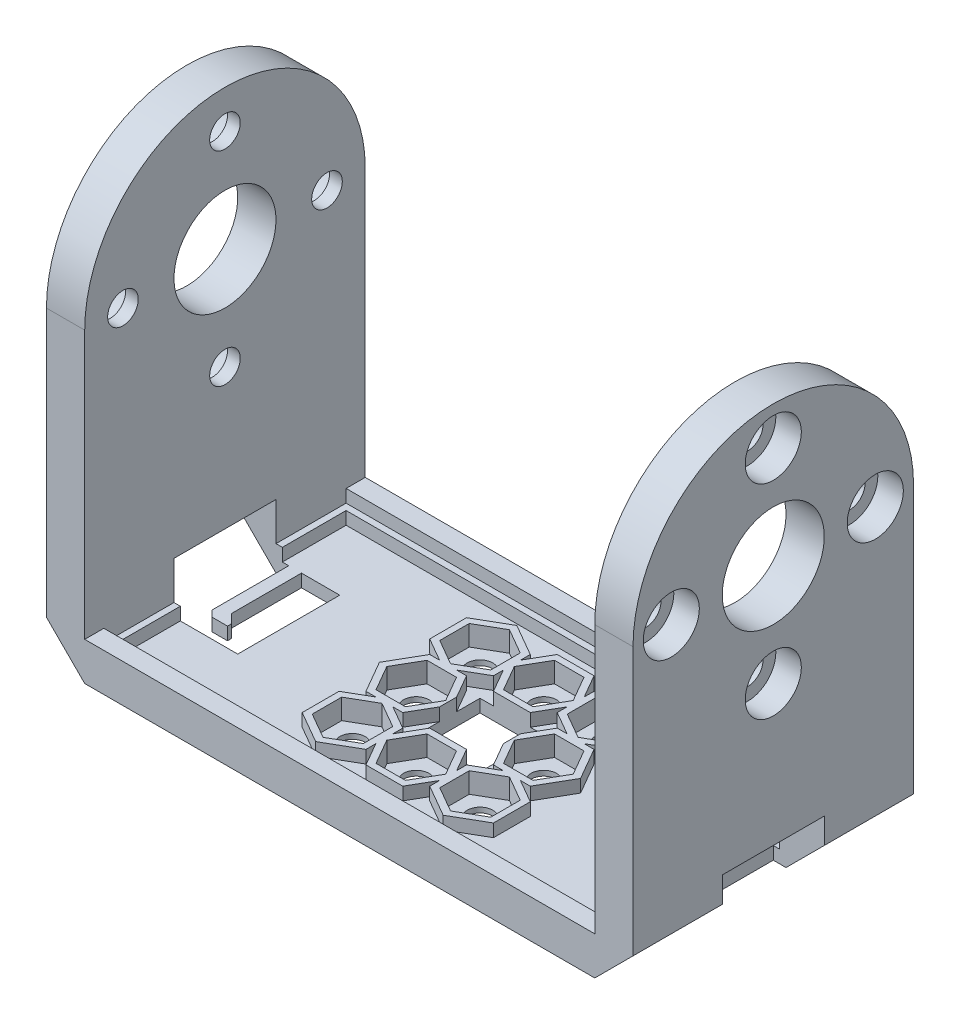
from build123d import *

# Parameters (mm, degrees)
SKETCH1_W                      = 46
SKETCH1_H                      = 22
BOSS_EXTRUDE1_DEPTH            = 3
SKETCH2_W                      = 3
SKETCH2_H                      = 22
BOSS_EXTRUDE2_DEPTH            = 32
CUT_EXTRUDE2_DEPTH             = 48.30750469
CUT_EXTRUDE3_DEPTH             = 59.838762733
SKETCH7_R                      = 4
CUT_EXTRUDE4_DEPTH             = 59.838762733
CBORE_FOR_M2_SHCS1_D           = 2.4
CBORE_FOR_M2_SHCS1_DEPTH       = 3
CBORE_FOR_M2_SHCS1_CBORE_D     = 4.4
CBORE_FOR_M2_SHCS1_CBORE_DEPTH = 2
CBORE_FOR_M2_SHCS1_TIP         = 0.721032743
CBORE_FOR_M2_SHCS2_D           = 2.4
CBORE_FOR_M2_SHCS2_CBORE_D     = 4.4
CBORE_FOR_M2_SHCS2_CBORE_DEPTH = 2
SKETCH15_W                     = 40
SKETCH15_H                     = 19
CUT_EXTRUDE5_DEPTH             = 1
CUT_EXTRUDE7_DEPTH             = 1.6
F_2_0_2_DIAMETER_HOLE1_D       = 2
F_2_0_2_DIAMETER_HOLE1_DEPTH   = 10
F_2_0_2_DIAMETER_HOLE1_TIP     = 0.600860619
SKETCH21_W                     = 5
SKETCH21_H                     = 5
CUT_EXTRUDE8_DEPTH             = 42.701318924
SKETCH22_W                     = 39
SKETCH22_H                     = 18
CUT_EXTRUDE9_DEPTH             = 1
SKETCH23_W                     = 8
SKETCH23_H                     = 4
CUT_EXTRUDE10_DEPTH            = 11
SKETCH24_W                     = 6
SKETCH24_H                     = 8
CUT_EXTRUDE11_DEPTH            = 3
SKETCH26_W                     = 8
SKETCH26_H                     = 4
CUT_EXTRUDE12_DEPTH            = 11
BOSS_EXTRUDE4_DEPTH            = 1


with BuildPart() as part:
    # Sketch1 → Boss-Extrude1 (new body)
    with BuildSketch(Plane(origin=(0, 0, 0), x_dir=(1, 0, 0), z_dir=(0, 1, 0))):
        Rectangle(SKETCH1_W, SKETCH1_H)
    extrude(amount=BOSS_EXTRUDE1_DEPTH)

    # Sketch2 → Boss-Extrude2 (add)
    with BuildSketch(Plane(origin=(0, 3, 0), x_dir=(1, 0, 0), z_dir=(0, 1, 0))):
        with Locations((-21.5, 0)):
            Rectangle(SKETCH2_W, SKETCH2_H)
        with Locations((21.5, 0)):
            Rectangle(SKETCH2_W, SKETCH2_H)
    extrude(amount=BOSS_EXTRUDE2_DEPTH)

    # Sketch4 → Cut-Extrude2 (cut, through all)
    with BuildSketch(Plane(origin=(0, 0, -11), x_dir=(-1, 0, 0), z_dir=(0, 0, -1))):
        Polygon((-23, 3), (-20, 0), (-23, 0), align=None)
        Polygon((23, 3), (20, 0), (23, 0), align=None)
    extrude(amount=-CUT_EXTRUDE2_DEPTH, mode=Mode.SUBTRACT)

    # Sketch6 → Cut-Extrude3 (cut, through all)
    with BuildSketch(Plane.ZY.offset(23)):
        with BuildLine():
            ThreePointArc((-11, 24), (-7.778174593, 31.778174593), (0, 35))
            Line((0, 35), (-11, 35))
            Line((-11, 35), (-11, 24))
        make_face()
        with BuildLine():
            Line((11, 35), (0, 35))
            ThreePointArc((0, 35), (7.778174593, 31.778174593), (11, 24))
            Line((11, 24), (11, 35))
        make_face()
    extrude(amount=-CUT_EXTRUDE3_DEPTH, mode=Mode.SUBTRACT)

    # Sketch7 → Cut-Extrude4 (cut, through all)
    with BuildSketch(Plane.ZY.offset(23)):
        with Locations((0, 24)):
            Circle(SKETCH7_R)
    extrude(amount=-CUT_EXTRUDE4_DEPTH, mode=Mode.SUBTRACT)

    # CBORE for M2 SHCS1
    with Locations(Plane.ZY.offset(23)):
        with Locations((0, 32), (8, 24), (0, 16), (-8, 24)):
            CounterBoreHole(CBORE_FOR_M2_SHCS1_D / 2, CBORE_FOR_M2_SHCS1_CBORE_D / 2, CBORE_FOR_M2_SHCS1_CBORE_DEPTH, depth=CBORE_FOR_M2_SHCS1_DEPTH)
            with Locations((0, 0, -(CBORE_FOR_M2_SHCS1_DEPTH + CBORE_FOR_M2_SHCS1_TIP / 2))):  # 118° drill point
                Cone(0, CBORE_FOR_M2_SHCS1_D / 2, CBORE_FOR_M2_SHCS1_TIP, mode=Mode.SUBTRACT)

    # CBORE for M2 SHCS2 (through all)
    with Locations(Plane(origin=(23, 0, 0), x_dir=(0, 0, -1), z_dir=(1, 0, 0))):
        with Locations((0, 32), (8, 24), (0, 16), (-8, 24)):
            CounterBoreHole(CBORE_FOR_M2_SHCS2_D / 2, CBORE_FOR_M2_SHCS2_CBORE_D / 2, CBORE_FOR_M2_SHCS2_CBORE_DEPTH)

    # Sketch15 → Cut-Extrude5 (cut)
    with BuildSketch(Plane(origin=(0, 3, 0), x_dir=(1, 0, 0), z_dir=(0, 1, 0))):
        Rectangle(SKETCH15_W, SKETCH15_H)
    extrude(amount=-CUT_EXTRUDE5_DEPTH, mode=Mode.SUBTRACT)

    # Sketch17 → Cut-Extrude7 (cut)
    with BuildSketch(Plane(origin=(0, 2, 0), x_dir=(1, 0, 0), z_dir=(0, 1, 0))):
        Polygon((-3, 3.845299462), (-3, 6.154700538), (-5, 7.309401077), (-7, 6.154700538), (-7, 3.845299462), (-5, 2.690598923), align=None)
        Polygon((1.154700538, 3), (2.309401077, 5), (1.154700538, 7), (-1.154700538, 7), (-2.309401077, 5), (-1.154700538, 3), align=None)
        Polygon((5, 2.690598923), (7, 3.845299462), (7, 6.154700538), (5, 7.309401077), (3, 6.154700538), (3, 3.845299462), align=None)
        Polygon((-3.845299462, -2), (-2.690598923, 0), (-3.845299462, 2), (-6.154700538, 2), (-7.309401077, 0), (-6.154700538, -2), align=None)
        Polygon((0, -2.309401077), (2, -1.154700538), (2, 1.154700538), (0, 2.309401077), (-2, 1.154700538), (-2, -1.154700538), align=None)
        Polygon((7.309401077, 0), (6.154700538, 2), (3.845299462, 2), (2.690598923, 0), (3.845299462, -2), (6.154700538, -2), align=None)
        Polygon((-3, -6.154700538), (-3, -3.845299462), (-5, -2.690598923), (-7, -3.845299462), (-7, -6.154700538), (-5, -7.309401077), align=None)
        Polygon((1.154700538, -7), (2.309401077, -5), (1.154700538, -3), (-1.154700538, -3), (-2.309401077, -5), (-1.154700538, -7), align=None)
        Polygon((5, -7.309401077), (7, -6.154700538), (7, -3.845299462), (5, -2.690598923), (3, -3.845299462), (3, -6.154700538), align=None)
    extrude(amount=-CUT_EXTRUDE7_DEPTH, mode=Mode.SUBTRACT)

    # Ø2.0 (2) Diameter Hole1
    with Locations(Plane(origin=(0, 0.4, 0), x_dir=(1, 0, 0), z_dir=(0, 1, 0))):
        with Locations((5, 0), (0, 5), (5, 5), (0, -5), (0, 0), (-5, 0), (-5, -5), (-5, 5), (5, -5)):
            Hole(F_2_0_2_DIAMETER_HOLE1_D / 2, depth=F_2_0_2_DIAMETER_HOLE1_DEPTH)
            with Locations((0, 0, -(F_2_0_2_DIAMETER_HOLE1_DEPTH + F_2_0_2_DIAMETER_HOLE1_TIP / 2))):  # 118° drill point
                Cone(0, F_2_0_2_DIAMETER_HOLE1_D / 2, F_2_0_2_DIAMETER_HOLE1_TIP, mode=Mode.SUBTRACT)

    # Sketch21 → Cut-Extrude8 (cut, through all)
    with BuildSketch(Plane(origin=(0, 2, 0), x_dir=(1, 0, 0), z_dir=(0, 1, 0))):
        Rectangle(SKETCH21_W, SKETCH21_H)
    extrude(amount=-CUT_EXTRUDE8_DEPTH, mode=Mode.SUBTRACT)

    # Sketch22 → Cut-Extrude9 (cut)
    # profile 1 of 5: a face of its own
    with BuildSketch(Plane(origin=(0, 2, 0), x_dir=(1, 0, 0), z_dir=(0, 1, 0))):
        Rectangle(SKETCH22_W, SKETCH22_H)
        Polygon((-2.5, 5.669872981), (-2.5, 6.443375673), (-5, 7.886751346), (-7.5, 6.443375673), (-7.5, 3.556624327), (-5.669872981, 2.5), (-6.443375673, 2.5), (-7.886751346, 0), (-6.443375673, -2.5), (-5.669872981, -2.5), (-7.5, -3.556624327), (-7.5, -6.443375673), (-5, -7.886751346), (-2.5, -6.443375673), (-2.5, -5.669872981), (-1.443375673, -7.5), (1.443375673, -7.5), (2.5, -5.669872981), (2.5, -6.443375673), (5, -7.886751346), (7.5, -6.443375673), (7.5, -3.556624327), (5.669872981, -2.5), (6.443375673, -2.5), (7.886751346, 0), (6.443375673, 2.5), (5.669872981, 2.5), (7.5, 3.556624327), (7.5, 6.443375673), (5, 7.886751346), (2.5, 6.443375673), (2.5, 5.669872981), (1.443375673, 7.5), (-1.443375673, 7.5), align=None, mode=Mode.SUBTRACT)
    # profile 2 of 5: a face of its own
    with BuildSketch(Plane(origin=(0, 2, 0), x_dir=(1, 0, 0), z_dir=(0, 1, 0))):
        Polygon((-3.556624327, 2.5), (-4.330127019, 2.5), (-2.5, 3.556624327), (-2.5, 4.330127019), (-1.443375673, 2.5), (-2.5, 2.5), (-2.5, 0.669872981), align=None)
    # profile 3 of 5: a face of its own
    with BuildSketch(Plane(origin=(0, 2, 0), x_dir=(1, 0, 0), z_dir=(0, 1, 0))):
        Polygon((2.5, 4.330127019), (2.5, 3.556624327), (4.330127019, 2.5), (3.556624327, 2.5), (2.5, 0.669872981), (2.5, 2.5), (1.443375673, 2.5), align=None)
    # profile 4 of 5: a face of its own
    with BuildSketch(Plane(origin=(0, 2, 0), x_dir=(1, 0, 0), z_dir=(0, 1, 0))):
        Polygon((4.330127019, -2.5), (2.5, -3.556624327), (2.5, -4.330127019), (1.443375673, -2.5), (2.5, -2.5), (2.5, -0.669872981), (3.556624327, -2.5), align=None)
    # profile 5 of 5: a face of its own
    with BuildSketch(Plane(origin=(0, 2, 0), x_dir=(1, 0, 0), z_dir=(0, 1, 0))):
        Polygon((-1.443375673, -2.5), (-2.5, -4.330127019), (-2.5, -3.556624327), (-4.330127019, -2.5), (-3.556624327, -2.5), (-2.5, -0.669872981), (-2.5, -2.5), align=None)
    extrude(amount=-CUT_EXTRUDE9_DEPTH, mode=Mode.SUBTRACT)

    # Sketch23 → Cut-Extrude10 (cut)
    with BuildSketch(Plane.ZY.offset(23)):
        with Locations((0, 3)):
            Rectangle(SKETCH23_W, SKETCH23_H)
    extrude(amount=-CUT_EXTRUDE10_DEPTH, mode=Mode.SUBTRACT)

    # Sketch24 → Cut-Extrude11 (cut)
    with BuildSketch(Plane.XZ):
        with Locations((-18, 0)):
            Rectangle(SKETCH24_W, SKETCH24_H)
        with Locations((18, 0)):
            Rectangle(SKETCH24_W, SKETCH24_H)
    extrude(amount=-CUT_EXTRUDE11_DEPTH, mode=Mode.SUBTRACT)

    # Sketch26 → Cut-Extrude12 (cut)
    with BuildSketch(Plane(origin=(23, 0, 0), x_dir=(0, 0, -1), z_dir=(1, 0, 0))):
        with Locations((0, 3)):
            Rectangle(SKETCH26_W, SKETCH26_H)
    extrude(amount=-CUT_EXTRUDE12_DEPTH, mode=Mode.SUBTRACT)

    # Sketch25 → Boss-Extrude4 (add)
    with BuildSketch(Plane.XZ):
        Polygon((-19, -4), (-19, 2), (-18.5, 2.5), (-17.3, 2.5), (-17.3, 2.2), (-18, 1.5), (-18, -4), align=None)
        Polygon((19, -4), (19, 2), (18.5, 2.5), (17.3, 2.5), (17.3, 2.2), (18, 1.5), (18, -4), align=None)
    extrude(amount=-BOSS_EXTRUDE4_DEPTH)


solid = part.part
